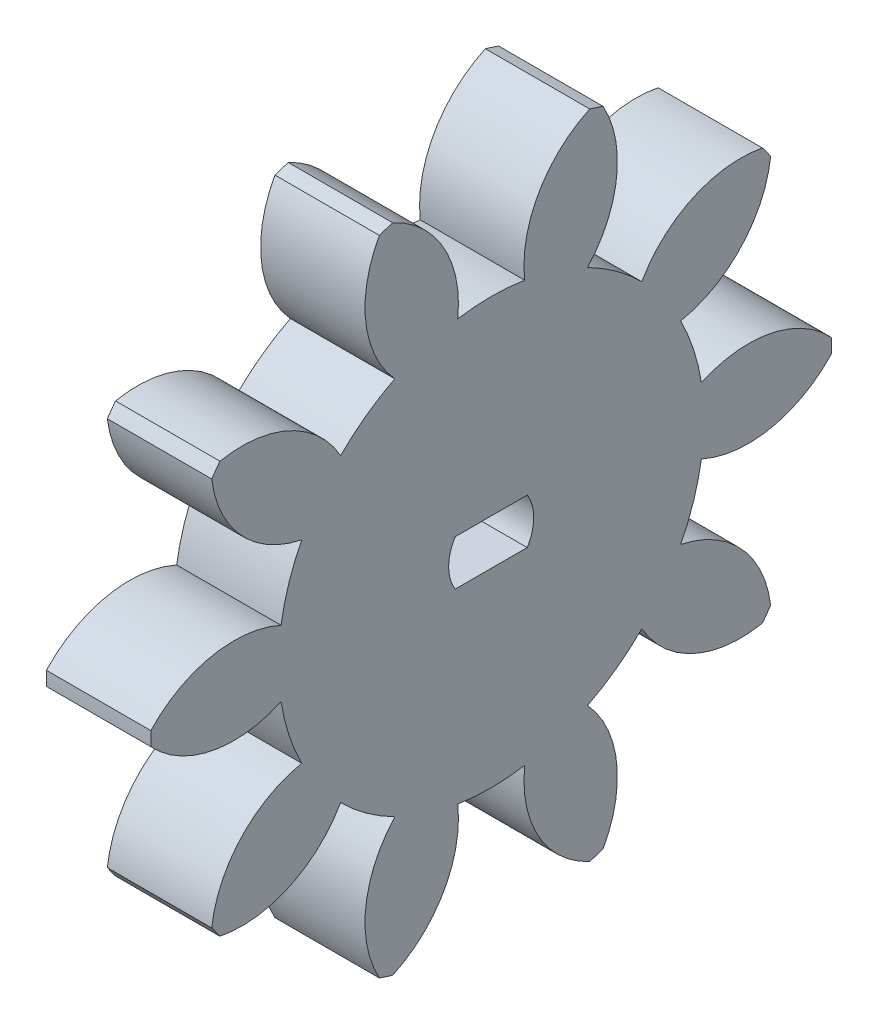
from build123d import *

# Parameters (mm, degrees)
BASPROSKE_W         = 5.842
BASPROSKE_H         = 19.05
TOOTHCUT_DEPTH      = 28.566899789
TEETHCUTS_COUNT     = 10
TEETHCUTS_ANGLE     = 324
BORSKE_R            = 2.38125
BORE_DEPTH          = 50.8000508
BOSS_EXTRUDE1_DEPTH = 5.842
BOSS_EXTRUDE2_DEPTH = 5.842


with BuildPart() as part:
    # BasProSke → Base-Revolve (revolve)
    with BuildSketch(Plane(origin=(0, 0, 0), x_dir=(1, 0, 0), z_dir=(0, 1, 0)), mode=Mode.PRIVATE) as base_revolve_sk:
        with Locations((2.921, 9.525)):
            Rectangle(BASPROSKE_W, BASPROSKE_H)
    revolve(base_revolve_sk.sketch.rotate(Axis((-10, 0, 0), (1, 0, 0)), 180), axis=Axis((-10, 0, 0), (1, 0, 0)))

    # TooCutSke → ToothCut (cut, through all)
    with BuildSketch(Plane(origin=(0, 0, 0), x_dir=(0, 0, -1), z_dir=(1, 0, 0))):
        with BuildLine():
            ThreePointArc((1.873548596, 11.756630659), (0, 11.90498), (-1.873548596, 11.756630659))
            ThreePointArc((-1.873548596, 11.756630659), (-2.656568084, 15.60034376), (-5.548507123, 18.250615164))
            ThreePointArc((-5.548507123, 18.250615164), (0, 19.0754), (5.548507123, 18.250615164))
            ThreePointArc((5.548507123, 18.250615164), (2.656568084, 15.60034376), (1.873548596, 11.756630659))
        make_face()
    toothcut = extrude(amount=TOOTHCUT_DEPTH, mode=Mode.SUBTRACT)

    # TeethCuts: ToothCut ×10 about axis
    teethcuts_axis = Axis((-10, 0, 0), (1, 0, 0))
    for i in range(1, TEETHCUTS_COUNT):
        add(toothcut.rotate(teethcuts_axis, i * TEETHCUTS_ANGLE / (TEETHCUTS_COUNT - 1)), mode=Mode.SUBTRACT)

    # BorSke → Bore (cut, symmetric)
    with BuildSketch(Plane(origin=(0, 0, 0), x_dir=(0, 0, -1), z_dir=(1, 0, 0))):
        with Locations(Location((0, 0, 0), (0, 0, 180))):
            Circle(BORSKE_R)
    extrude(amount=BORE_DEPTH, both=True, mode=Mode.SUBTRACT)

    # Sketch1 → Boss-Extrude1 (add)
    with BuildSketch(Plane(origin=(5.842, 0, 0), x_dir=(0, 0, -1), z_dir=(1, 0, 0))):
        with BuildLine():
            Line((-4.4067353, 4.572), (4.4067353, 4.572))
            ThreePointArc((4.4067353, 4.572), (0, 6.35), (-4.4067353, 4.572))
        make_face()
    extrude(amount=-BOSS_EXTRUDE1_DEPTH)

    # Sketch2 → Boss-Extrude2 (add)
    with BuildSketch(Plane(origin=(5.842, 0, 0), x_dir=(0, 0, -1), z_dir=(1, 0, 0))):
        with BuildLine():
            Line((-2.177028232, 1.27), (2.177028232, 1.27))
            ThreePointArc((2.177028232, 1.27), (0, 2.520387256), (-2.177028232, 1.27))
        make_face()
        with BuildLine():
            Line((-2.177028232, -1.27), (2.177028232, -1.27))
            ThreePointArc((2.177028232, -1.27), (0, -2.520387256), (-2.177028232, -1.27))
        make_face()
    extrude(amount=-BOSS_EXTRUDE2_DEPTH)


solid = part.part
